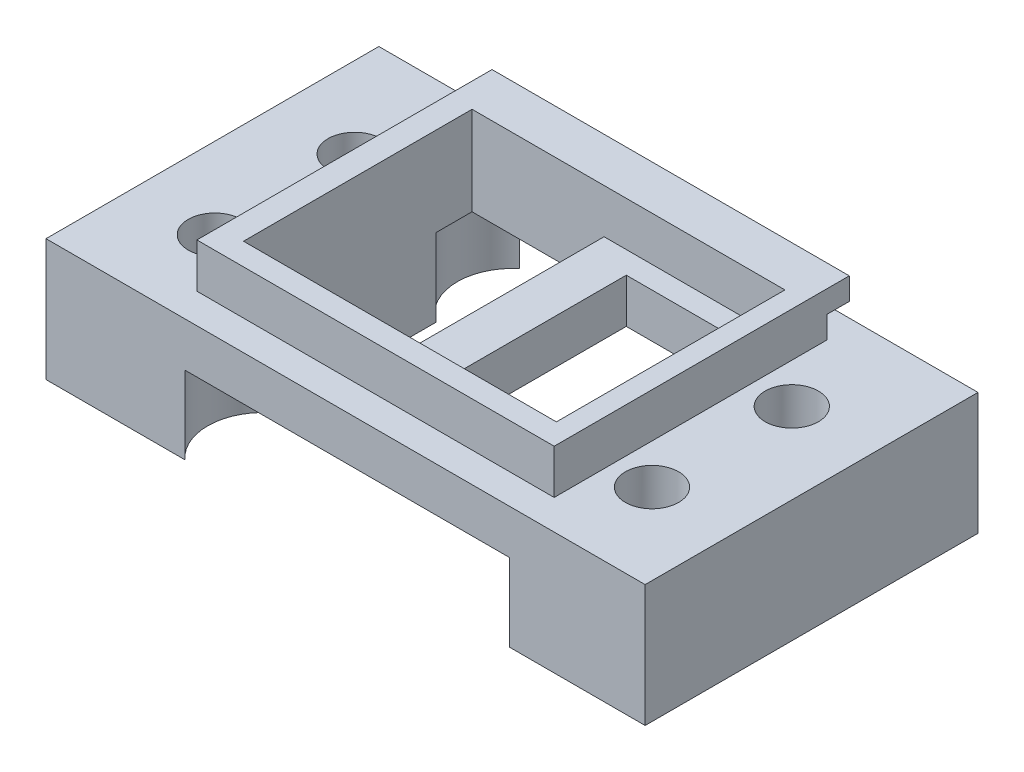
from build123d import *

# Parameters (mm, degrees)
SKETCH2_W               = 20
SKETCH2_H               = 15
BOSS_EXTRUDE1_DEPTH     = 2
SKETCH3_W               = 16.1
SKETCH3_H               = 12.3
SKETCH3_W_2             = 14.1
SKETCH3_H_2             = 10.3
BOSS_EXTRUDE2_DEPTH     = 2
SKETCH4_W               = 5.95
SKETCH4_H               = 9.3
SKETCH4_W_2             = 6.15
CUT_EXTRUDE1_DEPTH      = 2
SKETCH7_W               = 16.1
SKETCH7_H               = 1
BOSS_EXTRUDE3_DEPTH     = 1
SKETCH8_W               = 2
SKETCH8_H               = 15
BOSS_EXTRUDE4_DEPTH     = 30
CUT_EXTRUDE2_DEPTH      = 20
BOSS_EXTRUDE5_START     = -2
SKETCH11_W              = 3.5
SKETCH11_H              = 15
BOSS_EXTRUDE5_DEPTH     = 5.5
CUT_EXTRUDE3_DEPTH      = 37.417267719
CUT_EXTRUDE3_DEPTH_BACK = 37.417267719
SKETCH10_R              = 1.2
BOSS_EXTRUDE6_DEPTH     = 3.5
CUT_EXTRUDE4_START      = -30
SKETCH14_W              = 2
SKETCH14_H              = 15
CUT_EXTRUDE4_DEPTH      = 30
SKETCH15_R              = 2.5
CUT_EXTRUDE5_DEPTH      = 3.5


with BuildPart() as part:
    # Sketch2 → Boss-Extrude1 (new body)
    with BuildSketch(Plane(origin=(0, 0, 0), x_dir=(1, 0, 0), z_dir=(0, 1, 0))):
        with Locations((0.615034169, -2.648063781)):
            Rectangle(SKETCH2_W, SKETCH2_H)
    extrude(amount=BOSS_EXTRUDE1_DEPTH)

    # Sketch3 → Boss-Extrude2 (add)
    with BuildSketch(Plane(origin=(0, 2, 0), x_dir=(1, 0, 0), z_dir=(0, 1, 0))):
        with Locations((0.615034169, -2.648063781)):
            Rectangle(SKETCH3_W, SKETCH3_H)
        with Locations((0.715034169, -2.648063781)):
            Rectangle(SKETCH3_W_2, SKETCH3_H_2, mode=Mode.SUBTRACT)
    extrude(amount=BOSS_EXTRUDE2_DEPTH)

    # Sketch4 → Cut-Extrude1 (cut)
    with BuildSketch(Plane(origin=(0, 2, 0), x_dir=(1, 0, 0), z_dir=(0, 1, 0))):
        with Locations((-3.359965831, -2.148063781)):
            Rectangle(SKETCH4_W, SKETCH4_H)
        with Locations((4.690034169, -3.148063781)):
            Rectangle(SKETCH4_W_2, SKETCH4_H)
    extrude(amount=-CUT_EXTRUDE1_DEPTH, mode=Mode.SUBTRACT)

    # Sketch7 → Boss-Extrude3 (add)
    with BuildSketch(Plane(origin=(0, 0, -3.501936219), x_dir=(-1, 0, 0), z_dir=(0, 0, -1))):
        with Locations((-0.615034169, 3.5)):
            Rectangle(SKETCH7_W, SKETCH7_H)
    extrude(amount=BOSS_EXTRUDE3_DEPTH)

    # Sketch8 → Boss-Extrude4 (add)
    with BuildSketch(Plane(origin=(0, 0, 0), x_dir=(-1, 0, 0), z_dir=(0, -1, 0))):
        with Locations((-0.615034169, -2.648063781)):
            Rectangle(SKETCH8_W, SKETCH8_H)
    extrude(amount=BOSS_EXTRUDE4_DEPTH)

    # Sketch9 → Cut-Extrude2 (cut)
    with BuildSketch(Plane(origin=(1.615034169, 0, 0), x_dir=(0, 0, -1), z_dir=(1, 0, 0))):
        with BuildLine():
            Line((-4.448063781, -27), (-4.448063781, -3))
            ThreePointArc((-4.448063781, -3), (-2.648063781, -1.2), (-0.848063781, -3))
            Line((-0.848063781, -3), (-0.848063781, -27))
            ThreePointArc((-0.848063781, -27), (-2.648063781, -28.8), (-4.448063781, -27))
        make_face()
    extrude(amount=-CUT_EXTRUDE2_DEPTH, mode=Mode.SUBTRACT)

    # Sketch11 → Boss-Extrude5 (add)
    with BuildSketch(Plane.XZ.offset(BOSS_EXTRUDE5_START)):
        with Locations((-11.134965831, 2.648063781)):
            Rectangle(SKETCH11_W, SKETCH11_H)
        with Locations((12.365034169, 2.648063781)):
            Rectangle(SKETCH11_W, SKETCH11_H)
    extrude(amount=BOSS_EXTRUDE5_DEPTH)

    # Sketch10 → Cut-Extrude3 (cut, two sides: drawn at the far end of the back side and taken through both)
    with BuildSketch(Plane(origin=(0, 2, 0), x_dir=(1, 0, 0), z_dir=(0, 1, 0)).offset(-CUT_EXTRUDE3_DEPTH_BACK)):
        with Locations(Location((10.465034169, -6.189063781, 0), (0, 0, 270))):
            Circle(SKETCH10_R)
        with Locations(Location((10.465034169, 0.110936219, 0), (0, 0, 270))):
            Circle(SKETCH10_R)
        with Locations(Location((-9.234965831, 0.110936219, 0), (0, 0, 262.819244219))):
            Circle(SKETCH10_R)
        with Locations(Location((-9.234965831, -6.189063781, 0), (0, 0, 262.819244219))):
            Circle(SKETCH10_R)
    extrude(amount=CUT_EXTRUDE3_DEPTH + CUT_EXTRUDE3_DEPTH_BACK, mode=Mode.SUBTRACT)

    # Sketch12 → Boss-Extrude6 (add)
    with BuildSketch(Plane.XZ):
        with BuildLine():
            Line((-9.384965831, 10.148063781), (-6.334965831, 10.148063781))
            Line((-6.334965831, 10.148063781), (-6.334965831, -4.851936219))
            Line((-6.334965831, -4.851936219), (-9.384965831, -4.851936219))
            Line((-9.384965831, -4.851936219), (-9.384965831, -1.301524309))
            ThreePointArc((-9.384965831, -1.301524309), (-7.967548613, -0.110936219), (-9.384965831, 1.079651871))
            Line((-9.384965831, 1.079651871), (-9.384965831, 4.998475691))
            ThreePointArc((-9.384965831, 4.998475691), (-7.992687526, 6.189063781), (-9.384965831, 7.379651871))
            Line((-9.384965831, 7.379651871), (-9.384965831, 10.148063781))
        make_face()
        with BuildLine():
            Line((10.615034169, 10.148063781), (7.765034169, 10.148063781))
            Line((7.765034169, 10.148063781), (7.765034169, -4.851936219))
            Line((7.765034169, -4.851936219), (10.615034169, -4.851936219))
            Line((10.615034169, -4.851936219), (10.615034169, -1.301524309))
            ThreePointArc((10.615034169, -1.301524309), (9.240842733, -0.110936219), (10.615034169, 1.079651871))
            Line((10.615034169, 1.079651871), (10.615034169, 4.998475691))
            ThreePointArc((10.615034169, 4.998475691), (9.247628084, 6.189063781), (10.615034169, 7.379651871))
            Line((10.615034169, 7.379651871), (10.615034169, 10.148063781))
        make_face()
    extrude(amount=BOSS_EXTRUDE6_DEPTH)

    # Sketch13 → Cut-Revolve1 (revolve, cut)
    with BuildSketch(Plane(origin=(0, 0, -4.501936219), x_dir=(-1, 0, 0), z_dir=(0, 0, -1))):
        with BuildLine():
            Line((6.745006335, 3.804454393), (6.745006335, 3.302520584))
            ThreePointArc((6.745006335, 3.302520584), (6.99597324, 3.553487488), (6.745006335, 3.804454393))
        make_face()
    revolve(axis=Axis((-6.745006335, 3.302520584, -4.501936219), (0, -1, 0)), mode=Mode.SUBTRACT)

    # Sketch14 → Cut-Extrude4 (cut)
    with BuildSketch(Plane.XZ.offset(30).offset(CUT_EXTRUDE4_START)):
        with Locations((0.615034169, 2.648063781)):
            Rectangle(SKETCH14_W, SKETCH14_H)
    extrude(amount=CUT_EXTRUDE4_DEPTH, mode=Mode.SUBTRACT)

    # Sketch15 → Cut-Extrude5 (cut)
    with BuildSketch(Plane.XZ.offset(3.5)):
        with Locations((-4.936579387, 8.307002095)):
            Circle(SKETCH15_R)
        with Locations((6.313420613, 8.307002095)):
            Circle(SKETCH15_R)
        with Locations((6.313420613, -2.942997905)):
            Circle(SKETCH15_R)
        with Locations((-4.936579387, -2.942997905)):
            Circle(SKETCH15_R)
    extrude(amount=-CUT_EXTRUDE5_DEPTH, mode=Mode.SUBTRACT)


solid = part.part
